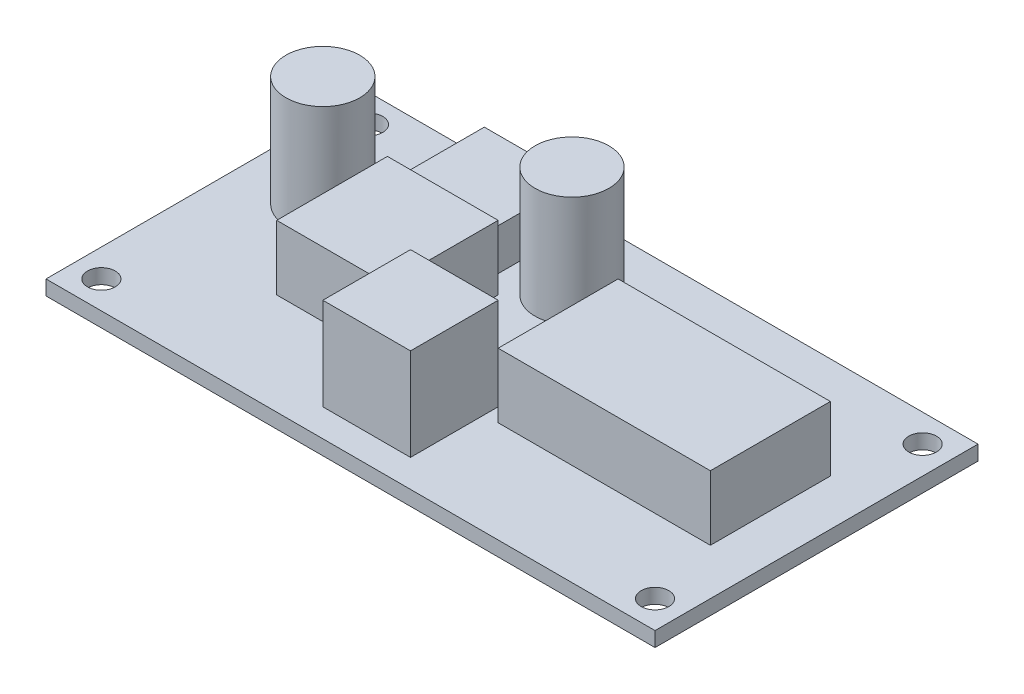
from build123d import *

# Parameters (mm, degrees)
SKETCH1_W               = 66
SKETCH1_H               = 35
PCB_DEPTH               = 1.6
MOUNT_HOLE_1_DEPTH      = 75.723222629
MOUNT_HOLE_1_DEPTH_BACK = 75.723222629
SKETCH2_R               = 1.5
MOUNT_HOLE_2_DEPTH      = 75.723222629
MOUNT_HOLE_2_DEPTH_BACK = 75.723222629
SKETCH3_R               = 1.5
MOUNT_HOLE_3_DEPTH      = 75.723222629
MOUNT_HOLE_3_DEPTH_BACK = 75.723222629
SKETCH4_R               = 1.5
MOUNT_HOLE_4_DEPTH      = 75.723222629
MOUNT_HOLE_4_DEPTH_BACK = 75.723222629
SKETCH5_R               = 1.5
VOLTMETER_DISPLAY_START = 1.6
SKETCH6_W               = 23
SKETCH6_H               = 13
VOLTMETER_DISPLAY_DEPTH = 7
INDUCTOR_START          = 1.6
SKETCH7_W               = 12
SKETCH7_H               = 12
INDUCTOR_DEPTH          = 7
CAP_IN_START            = 1.6
SKETCH8_R               = 4
CAP_IN_DEPTH            = 12
CAP_OUT_START           = 1.6
SKETCH9_R               = 4
CAP_OUT_DEPTH           = 12
TRIM_POT_START          = 1.6
SKETCH10_W              = 9.5
SKETCH10_H              = 9.5
TRIM_POT_DEPTH          = 10
LM2596_START            = 1.6
SKETCH11_W              = 10
SKETCH11_H              = 8.5
LM2596_DEPTH            = 4.5


with BuildPart() as part:
    # Sketch1 → PCB (new body)
    with BuildSketch(Plane(origin=(0, 0, 0), x_dir=(1, 0, 0), z_dir=(0, 1, 0))):
        with Locations((33, 17.5)):
            Rectangle(SKETCH1_W, SKETCH1_H)
    extrude(amount=PCB_DEPTH)

    # Sketch2 → Mount_hole_1 (cut, two sides: drawn at the far end of the back side and taken through both)
    with BuildSketch(Plane(origin=(0, 0, 0), x_dir=(1, 0, 0), z_dir=(0, 1, 0)).offset(-MOUNT_HOLE_1_DEPTH_BACK)):
        with Locations(Location((3, 3, 0), (0, 0, 270))):
            Circle(SKETCH2_R)
    extrude(amount=MOUNT_HOLE_1_DEPTH + MOUNT_HOLE_1_DEPTH_BACK, mode=Mode.SUBTRACT)

    # Sketch3 → Mount_hole_2 (cut, two sides: drawn at the far end of the back side and taken through both)
    with BuildSketch(Plane(origin=(0, 0, 0), x_dir=(1, 0, 0), z_dir=(0, 1, 0)).offset(-MOUNT_HOLE_2_DEPTH_BACK)):
        with Locations(Location((63, 3, 0), (0, 0, 270))):
            Circle(SKETCH3_R)
    extrude(amount=MOUNT_HOLE_2_DEPTH + MOUNT_HOLE_2_DEPTH_BACK, mode=Mode.SUBTRACT)

    # Sketch4 → Mount_hole_3 (cut, two sides: drawn at the far end of the back side and taken through both)
    with BuildSketch(Plane(origin=(0, 0, 0), x_dir=(1, 0, 0), z_dir=(0, 1, 0)).offset(-MOUNT_HOLE_3_DEPTH_BACK)):
        with Locations(Location((3, 32, 0), (0, 0, 270))):
            Circle(SKETCH4_R)
    extrude(amount=MOUNT_HOLE_3_DEPTH + MOUNT_HOLE_3_DEPTH_BACK, mode=Mode.SUBTRACT)

    # Sketch5 → Mount_hole_4 (cut, two sides: drawn at the far end of the back side and taken through both)
    with BuildSketch(Plane(origin=(0, 0, 0), x_dir=(1, 0, 0), z_dir=(0, 1, 0)).offset(-MOUNT_HOLE_4_DEPTH_BACK)):
        with Locations(Location((63, 32, 0), (0, 0, 270))):
            Circle(SKETCH5_R)
    extrude(amount=MOUNT_HOLE_4_DEPTH + MOUNT_HOLE_4_DEPTH_BACK, mode=Mode.SUBTRACT)

    # Sketch6 → Voltmeter_display (add)
    with BuildSketch(Plane(origin=(0, 0, 0), x_dir=(1, 0, 0), z_dir=(0, 1, 0)).offset(VOLTMETER_DISPLAY_START)):
        with Locations((49.5, 17.5)):
            Rectangle(SKETCH6_W, SKETCH6_H)
    extrude(amount=VOLTMETER_DISPLAY_DEPTH)

    # Sketch7 → Inductor (add)
    with BuildSketch(Plane(origin=(0, 0, 0), x_dir=(1, 0, 0), z_dir=(0, 1, 0)).offset(INDUCTOR_START)):
        with Locations((20, 17)):
            Rectangle(SKETCH7_W, SKETCH7_H)
    extrude(amount=INDUCTOR_DEPTH)

    # Sketch8 → Cap_in (add)
    with BuildSketch(Plane(origin=(0, 0, 0), x_dir=(1, 0, 0), z_dir=(0, 1, 0)).offset(CAP_IN_START)):
        with Locations(Location((8, 22, 0), (0, 0, 90))):
            Circle(SKETCH8_R)
    extrude(amount=CAP_IN_DEPTH)

    # Sketch9 → Cap_out (add)
    with BuildSketch(Plane(origin=(0, 0, 0), x_dir=(1, 0, 0), z_dir=(0, 1, 0)).offset(CAP_OUT_START)):
        with Locations(Location((30, 27, 0), (0, 0, 90))):
            Circle(SKETCH9_R)
    extrude(amount=CAP_OUT_DEPTH)

    # Sketch10 → Trim_pot (add)
    with BuildSketch(Plane(origin=(0, 0, 0), x_dir=(1, 0, 0), z_dir=(0, 1, 0)).offset(TRIM_POT_START)):
        with Locations((31.75, 7.75)):
            Rectangle(SKETCH10_W, SKETCH10_H)
    extrude(amount=TRIM_POT_DEPTH)

    # Sketch11 → LM2596 (add)
    with BuildSketch(Plane(origin=(0, 0, 0), x_dir=(1, 0, 0), z_dir=(0, 1, 0)).offset(LM2596_START)):
        with Locations((19, 29.25)):
            Rectangle(SKETCH11_W, SKETCH11_H)
    extrude(amount=LM2596_DEPTH)


solid = part.part
